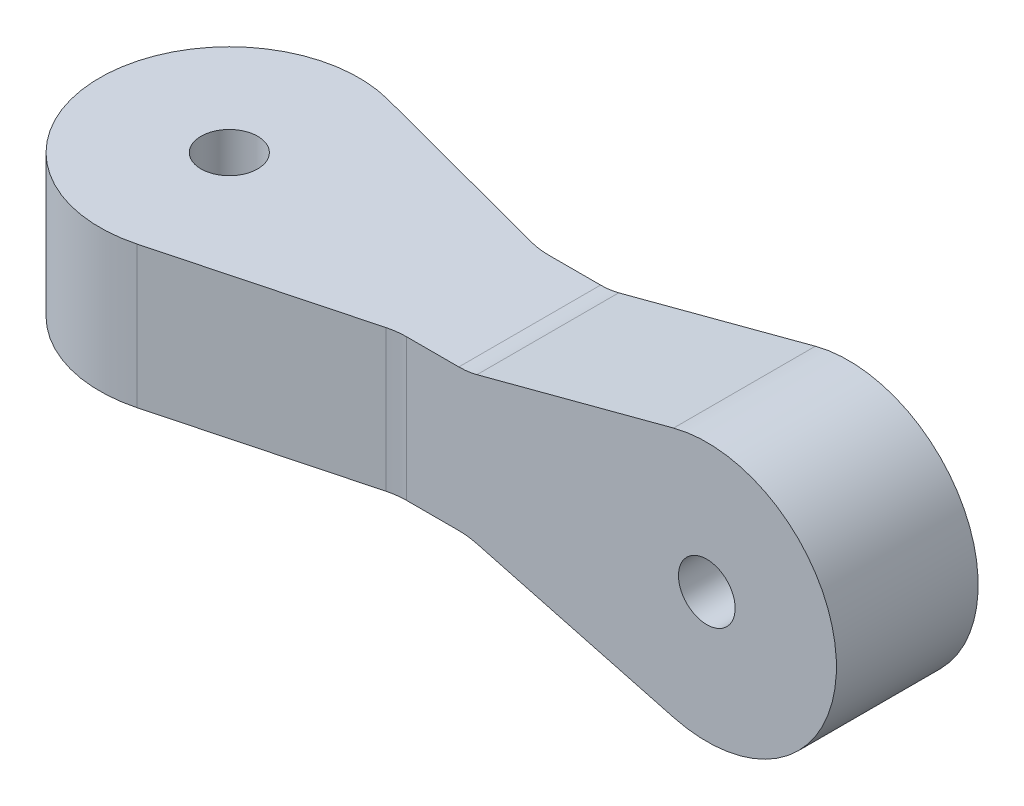
from build123d import *

# Parameters (mm, degrees)
SKETCH1_R           = 4
BOSS_EXTRUDE1_DEPTH = 10
SKETCH2_W           = 20
SKETCH2_H           = 20
BOSS_EXTRUDE2_DEPTH = 10
SKETCH3_R           = 4
BOSS_EXTRUDE4_DEPTH = 10
FILLET1_R           = 10


with BuildPart() as part:
    # Sketch1 → Boss-Extrude1 (new, symmetric)
    with BuildSketch(Plane.XY):
        with BuildLine():
            Line((-4.683153706, 17.681145748), (-33.683153706, 10))
            Line((-33.683153706, 10), (-33.683153706, -10))
            Line((-33.683153706, -10), (-4.683153706, -17.681145748))
            ThreePointArc((-4.683153706, -17.681145748), (18.290840429, 0), (-4.683153706, 17.681145748))
        make_face()
        Circle(SKETCH1_R, mode=Mode.SUBTRACT)
    extrude(amount=BOSS_EXTRUDE1_DEPTH, both=True)

    # Sketch2 → Boss-Extrude2 (add)
    with BuildSketch(Plane.ZY.offset(33.683153706)):
        Rectangle(SKETCH2_W, SKETCH2_H)
    extrude(amount=BOSS_EXTRUDE2_DEPTH)

    # Sketch3 → Boss-Extrude4 (add, symmetric)
    with BuildSketch(Plane(origin=(0, 0, 0), x_dir=(1, 0, 0), z_dir=(0, 1, 0))):
        with BuildLine():
            Line((-43.683153706, 10), (-72.683153706, 17.681145748))
            ThreePointArc((-72.683153706, 17.681145748), (-95.657147841, 0), (-72.683153706, -17.681145748))
            Line((-72.683153706, -17.681145748), (-43.683153706, -10))
            Line((-43.683153706, -10), (-43.683153706, 10))
        make_face()
        with Locations(Location((-77.366307412, 0, 0), (0, 0, 270))):
            Circle(SKETCH3_R, mode=Mode.SUBTRACT)
    extrude(amount=BOSS_EXTRUDE4_DEPTH, both=True)

    # Fillet1
    fillet1_edges = [part.edges().sort_by_distance(p)[0] for p in [
        (-43.683153706, 0, 10),
        (-43.683153706, 0, -10),
        (-33.683153706, -10, 0),
        (-33.683153706, 10, 0),
    ]]
    fillet(fillet1_edges, radius=FILLET1_R)


solid = part.part
